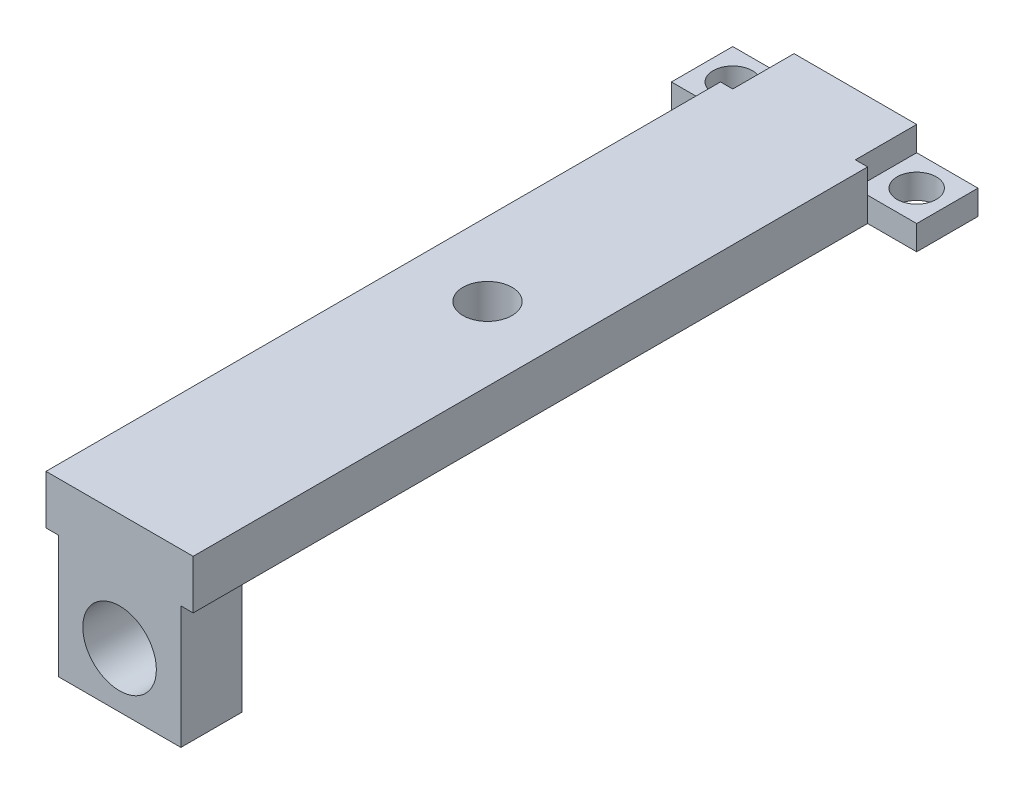
from build123d import *

# Parameters (mm, degrees)
SKETCH1_W           = 12
SKETCH1_H           = 60
BOSS_EXTRUDE1_DEPTH = 4
SKETCH2_W           = 10
SKETCH2_H           = 5
BOSS_EXTRUDE2_DEPTH = 10
CUT_EXTRUDE1_REACH  = 63.123
SKETCH3_R           = 3
SKETCH6_W           = 20
SKETCH6_H           = 5
BOSS_EXTRUDE4_DEPTH = 2
CUT_EXTRUDE2_REACH  = 35.823
SKETCH13_W          = 5
SKETCH13_H          = 5
CUT_EXTRUDE3_REACH  = 35.823
SKETCH14_R          = 1.6
CUT_EXTRUDE4_REACH  = 36.583
SKETCH4_R           = 2


with BuildPart() as part:
    # Sketch1 → Boss-Extrude1 (new body)
    with BuildSketch(Plane(origin=(0, 0, 0), x_dir=(1, 0, 0), z_dir=(0, 1, 0))):
        Rectangle(SKETCH1_W, SKETCH1_H)
    extrude(amount=BOSS_EXTRUDE1_DEPTH)

    # Sketch2 → Boss-Extrude2 (add)
    with BuildSketch(Plane.XZ):
        with Locations((0, 27.5)):
            Rectangle(SKETCH2_W, SKETCH2_H)
    extrude(amount=BOSS_EXTRUDE2_DEPTH)

    # Sketch3 → Cut-Extrude1 (cut, up to next)
    with BuildSketch(Plane.XY.offset(30), mode=Mode.PRIVATE) as cut_extrude1_sk1:
        with Locations((0, -5.5)):
            Circle(SKETCH3_R)
    cut_extrude1_tool1 = extrude(cut_extrude1_sk1.sketch, amount=-CUT_EXTRUDE1_REACH, mode=Mode.PRIVATE) & part.part
    add(cut_extrude1_tool1.solids().sort_by_distance((0, -5.5, 30))[0], mode=Mode.SUBTRACT)

    # Sketch6 → Boss-Extrude4 (add)
    with BuildSketch(Plane(origin=(0, 0, 0), x_dir=(1, 0, 0), z_dir=(0, 1, 0))):
        with Locations((0, 27.5)):
            Rectangle(SKETCH6_W, SKETCH6_H)
    extrude(amount=BOSS_EXTRUDE4_DEPTH)

    # Sketch13 → Cut-Extrude2 (cut, up to next)
    with BuildSketch(Plane(origin=(0, 2, 0), x_dir=(1, 0, 0), z_dir=(0, 1, 0)), mode=Mode.PRIVATE) as cut_extrude2_sk1:
        with Locations((-7.5, 27.5)):
            Rectangle(SKETCH13_W, SKETCH13_H)
    cut_extrude2_tool1 = extrude(cut_extrude2_sk1.sketch, amount=CUT_EXTRUDE2_REACH, mode=Mode.PRIVATE) & part.part
    cut_extrude2 = cut_extrude2_tool1.solids().sort_by_distance((-7.5, 2, -27.5))[0]
    add(cut_extrude2, mode=Mode.SUBTRACT)

    # Sketch14 → Cut-Extrude3 (cut, up to next)
    with BuildSketch(Plane(origin=(0, 2, 0), x_dir=(1, 0, 0), z_dir=(0, 1, 0)), mode=Mode.PRIVATE) as cut_extrude3_sk1:
        with Locations(Location((-7.5, 27.5, 0), (0, 0, 270))):
            Circle(SKETCH14_R)
    cut_extrude3_tool1 = extrude(cut_extrude3_sk1.sketch, amount=-CUT_EXTRUDE3_REACH, mode=Mode.PRIVATE) & part.part
    cut_extrude3 = cut_extrude3_tool1.solids().sort_by_distance((-7.5, 2, -27.5))[0]
    add(cut_extrude3, mode=Mode.SUBTRACT)

    # Mirror1: Cut-Extrude2, Cut-Extrude3 across plane
    add(cut_extrude2.mirror(Plane(origin=(0, 0, 0), x_dir=(0, 0, 1), z_dir=(1, 0, 0))), mode=Mode.SUBTRACT)
    add(cut_extrude3.mirror(Plane(origin=(0, 0, 0), x_dir=(0, 0, 1), z_dir=(1, 0, 0))), mode=Mode.SUBTRACT)

    # Sketch4 → Cut-Extrude4 (cut, up to next)
    with BuildSketch(Plane(origin=(0, 4, 0), x_dir=(1, 0, 0), z_dir=(0, 1, 0)), mode=Mode.PRIVATE) as cut_extrude4_sk1:
        with Locations(Location((0, 0, 0), (0, 0, 270))):
            Circle(SKETCH4_R)
    cut_extrude4_tool1 = extrude(cut_extrude4_sk1.sketch, amount=-CUT_EXTRUDE4_REACH, mode=Mode.PRIVATE) & part.part
    add(cut_extrude4_tool1.solids().sort_by_distance((0, 4, 0))[0], mode=Mode.SUBTRACT)


solid = part.part
